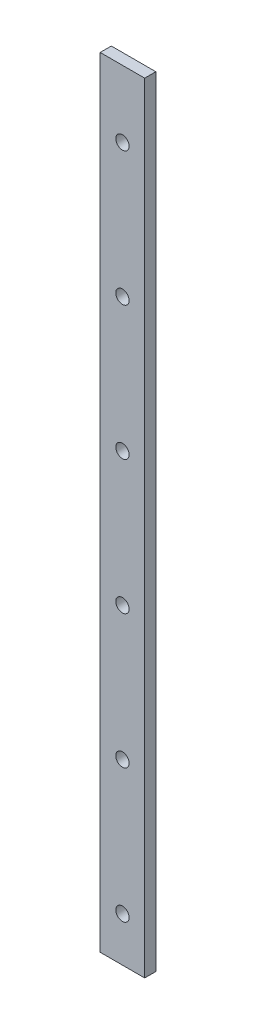
from build123d import *

# Parameters (mm, degrees)
SKIZZE1_W                       = 20
SKIZZE1_H                       = 350
AUFSATZ_LINEAR_AUSTRAGEN1_DEPTH = 5
SKIZZE2_R                       = 3
SCHNITT_LINEAR_AUSTRAGEN1_DEPTH = 10
LINEARES_MUSTER1_COUNT          = 6
LINEARES_MUSTER1_PITCH          = 60


with BuildPart() as part:
    # Skizze1 → Aufsatz-Linear austragen1 (new body)
    with BuildSketch(Plane.XY):
        with Locations((0, 175)):
            Rectangle(SKIZZE1_W, SKIZZE1_H)
    extrude(amount=AUFSATZ_LINEAR_AUSTRAGEN1_DEPTH)

    # Skizze2 → Schnitt-Linear austragen1 (cut)
    with BuildSketch(Plane.XY.offset(5)):
        with Locations((0, 20)):
            Circle(SKIZZE2_R)
    schnitt_linear_austragen1 = extrude(amount=-SCHNITT_LINEAR_AUSTRAGEN1_DEPTH, mode=Mode.SUBTRACT)

    # Lineares Muster1: Schnitt-Linear austragen1 ×6
    with Locations(*[(0, i * LINEARES_MUSTER1_PITCH, 0) for i in range(1, LINEARES_MUSTER1_COUNT)]):
        add(schnitt_linear_austragen1, mode=Mode.SUBTRACT)


solid = part.part
